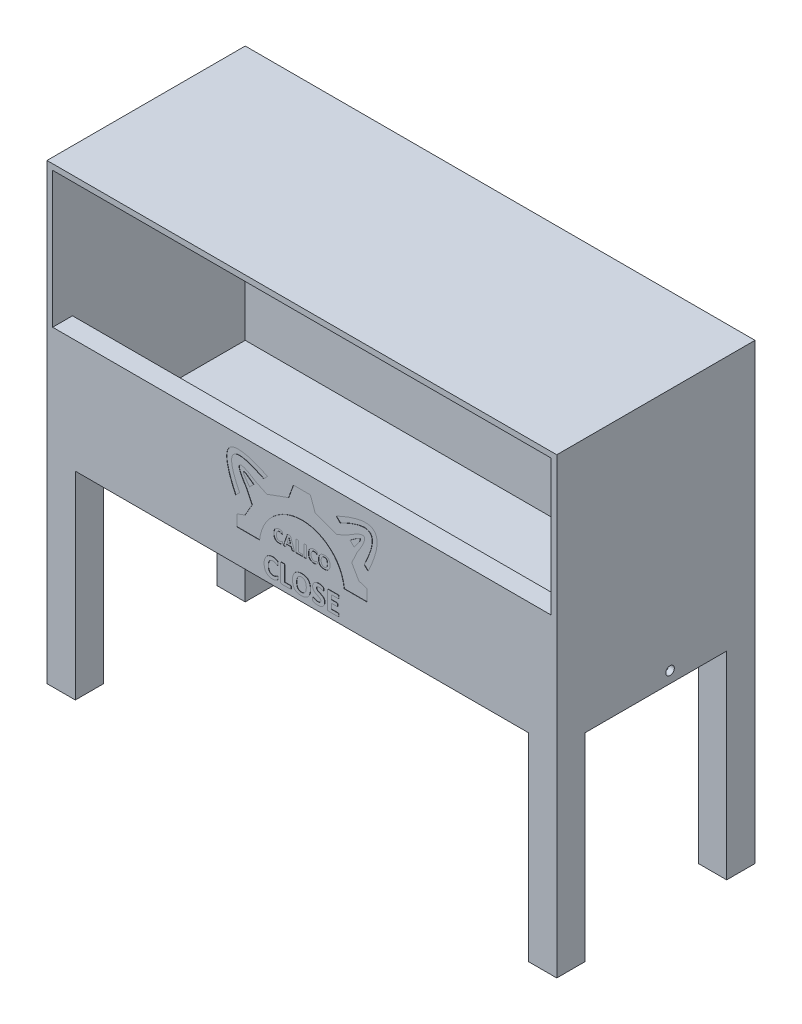
from build123d import *

# Parameters (mm, degrees)
SKETCH2_W           = 1800
SKETCH2_H           = 900
BOSS_EXTRUDE1_DEPTH = 700
SHELL1_T            = -20
SKETCH4_W           = 1800
SKETCH4_H           = 400
BOSS_EXTRUDE2_DEPTH = 20
SKETCH5_W           = 1760
SKETCH5_H           = 20
BOSS_EXTRUDE3_DEPTH = 50
SKETCH6_W           = 100
SKETCH6_H           = 100
BOSS_EXTRUDE4_DEPTH = 700
CUT_EXTRUDE3_REACH  = 2249.777
SKETCH11_R          = 15
CUT_EXTRUDE7_DEPTH  = 1
CUT_EXTRUDE8_DEPTH  = 1
BOSS_EXTRUDE5_DEPTH = 1


with BuildPart() as part:
    # Sketch2 → Boss-Extrude1 (new body)
    with BuildSketch(Plane.XY):
        Rectangle(SKETCH2_W, SKETCH2_H)
    extrude(amount=BOSS_EXTRUDE1_DEPTH)

    # Shell1
    shell1_openings = [part.faces().sort_by_distance(p)[0] for p in [
        (0, 0, 700),
    ]]
    offset(amount=SHELL1_T, openings=shell1_openings, kind=Kind.INTERSECTION)

    # Sketch4 → Boss-Extrude2 (add)
    with BuildSketch(Plane.XY.offset(700)):
        with Locations((0, -250)):
            Rectangle(SKETCH4_W, SKETCH4_H)
    extrude(amount=-BOSS_EXTRUDE2_DEPTH)

    # Sketch5 → Boss-Extrude3 (add)
    with BuildSketch(Plane(origin=(0, 0, 680), x_dir=(-1, 0, 0), z_dir=(0, 0, -1))):
        with Locations((0, -60)):
            Rectangle(SKETCH5_W, SKETCH5_H)
    extrude(amount=BOSS_EXTRUDE3_DEPTH)

    # Sketch6 → Boss-Extrude4 (add)
    with BuildSketch(Plane.XZ.offset(450)):
        with Locations((-850, 650)):
            Rectangle(SKETCH6_W, SKETCH6_H)
        with Locations((-850, 50)):
            Rectangle(SKETCH6_W, SKETCH6_H)
        with Locations((850, 50)):
            Rectangle(SKETCH6_W, SKETCH6_H)
        with Locations((850, 650)):
            Rectangle(SKETCH6_W, SKETCH6_H)
    extrude(amount=BOSS_EXTRUDE4_DEPTH)

    # Sketch11 → Cut-Extrude3 (cut, up to next)
    with BuildSketch(Plane(origin=(900, 0, 0), x_dir=(0, 0, -1), z_dir=(1, 0, 0)), mode=Mode.PRIVATE) as cut_extrude3_sk1:
        with Locations(Location((-300, -410, 0), (0, 0, 90))):
            Circle(SKETCH11_R)
    cut_extrude3_tool1 = extrude(cut_extrude3_sk1.sketch, amount=-CUT_EXTRUDE3_REACH, mode=Mode.PRIVATE) & part.part
    add(cut_extrude3_tool1.solids().sort_by_distance((900, -410, 300))[0], mode=Mode.SUBTRACT)

    # Sketch15 → Cut-Extrude7 (cut)
    # profile 1 of 3: a face of its own
    with BuildSketch(Plane.XY.offset(700)):
        with BuildLine():
            Line((-159.739380443, -165.494855592), (-123.487068962, -182.399586062))
            Line((-123.487068962, -182.399586062), (-47.101007166, -154.597333255))
            Line((-47.101007166, -154.597333255), (-30, -107.612702216))
            Line((-30, -107.612702216), (30, -107.612702216))
            Line((30, -107.612702216), (47.101007166, -154.597333255))
            Line((47.101007166, -154.597333255), (123.487068962, -182.399586062))
            Line((123.487068962, -182.399586062), (159.739380443, -165.494855592))
            add(Edge.make_bspline(
                [(159.739380443, -165.494855592), (262.269863715, -98.319711379), (195.094719502, -200.850194651)],
                knots=[0, 0, 0, 1, 1, 1], degree=2))
            Line((195.094719502, -200.850194651), (176.076897724, -241.634045068))
            Line((176.076897724, -241.634045068), (201.076897724, -284.935315257))
            Line((201.076897724, -284.935315257), (229.267676348, -295.195919557))
            Line((229.267676348, -295.195919557), (229.267676348, -335.195919557))
            Line((229.267676348, -335.195919557), (149.267676348, -335.195919557))
            ThreePointArc((149.267676348, -335.195919557), (0, -200), (-149.267676348, -335.195919557))
            Line((-149.267676348, -335.195919557), (-229.267676348, -335.195919557))
            Line((-229.267676348, -335.195919557), (-229.267676348, -295.195919557))
            Line((-229.267676348, -295.195919557), (-201.076897724, -284.935315257))
            Line((-201.076897724, -284.935315257), (-176.076897724, -241.634045068))
            Line((-176.076897724, -241.634045068), (-195.094719502, -200.850194651))
            add(Edge.make_bspline(
                [(-159.739380443, -165.494855592), (-262.269863715, -98.319711379), (-195.094719502, -200.850194651)],
                knots=[0, 0, 0, 1, 1, 1], degree=2))
        make_face()
        with BuildLine():
            Line((184.488117785, -190.243592933), (170.345982161, -176.10145731))
            add(Edge.make_bspline(
                [(170.345982161, -176.10145731), (233.985592468, -126.603982627), (184.488117785, -190.243592933)],
                knots=[0, 0, 0, 1, 1, 1], degree=2))
        make_face(mode=Mode.SUBTRACT)
        with BuildLine():
            add(Edge.make_bspline(
                [(-170.345982161, -176.10145731), (-233.985592468, -126.603982627), (-184.488117785, -190.243592933)],
                knots=[0, 0, 0, 1, 1, 1], degree=2))
            Line((-184.488117785, -190.243592933), (-170.345982161, -176.10145731))
        make_face(mode=Mode.SUBTRACT)
    # profile 2 of 3: a face of its own
    with BuildSketch(Plane.XY.offset(700)):
        with BuildLine():
            add(Edge.make_bspline(
                [(-134.990643102, -140.74611825), (-304.696270586, -55.893304508), (-219.843456844, -225.598931993)],
                knots=[0, 0, 0, 1, 1, 1], degree=2))
            Line((-219.843456844, -225.598931993), (-233.985592468, -239.741067616))
            add(Edge.make_bspline(
                [(-120.848507478, -126.603982627), (-332.980541834, -27.609033261), (-233.985592468, -239.741067616)],
                knots=[0, 0, 0, 1, 1, 1], degree=2))
            Line((-120.848507478, -126.603982627), (-134.990643102, -140.74611825))
        make_face()
    # profile 3 of 3: a face of its own
    with BuildSketch(Plane.XY.offset(700)):
        with BuildLine():
            Line((120.848507478, -126.603982627), (134.990643102, -140.74611825))
            add(Edge.make_bspline(
                [(134.990643102, -140.74611825), (304.696270586, -55.893304508), (219.843456844, -225.598931993)],
                knots=[0, 0, 0, 1, 1, 1], degree=2))
            Line((219.843456844, -225.598931993), (233.985592468, -239.741067616))
            add(Edge.make_bspline(
                [(120.848507478, -126.603982627), (332.980541834, -27.609033261), (233.985592468, -239.741067616)],
                knots=[0, 0, 0, 1, 1, 1], degree=2))
        make_face()
    extrude(amount=-CUT_EXTRUDE7_DEPTH, mode=Mode.SUBTRACT)

    # Sketch16 → Cut-Extrude8 (cut)
    # profile 1 of 6: a face of its own
    with BuildSketch(Plane.XY.offset(700)):
        with BuildLine():
            add(Edge.make_bspline(
                [(-68.169117647, -303.163061101), (-68.1694608, -303.409579145), (-68.170093462, -303.864078389), (-68.211999853, -304.49349041), (-68.264669746, -305.024016098), (-68.351140031, -305.47094076), (-68.470126206, -305.848624379), (-68.620502677, -306.194589099), (-68.862286707, -306.533596319), (-69.1069167, -306.853148187), (-69.379373769, -307.157451933), (-69.689771761, -307.415746233), (-70.07664001, -307.717525028), (-70.733910696, -308.170914471), (-71.717797889, -308.743575098), (-73.075797659, -309.399194562), (-74.667433676, -309.963478408), (-76.455242308, -310.441463704), (-78.43660149, -310.761976891), (-79.81793151, -310.799207569), (-80.532552083, -310.818468576)],
                knots=[0, 0, 0, 0, 0.817477301, 1.507162764, 2.091525744, 2.585101367, 3.013698999, 3.403571139, 3.830139735, 4.389521305, 4.739690108, 5.181838318, 5.726127005, 6.367582384, 7.828489835, 9.497787956, 11.362220851, 13.420571043, 15.630867283, 18, 18, 18, 18], degree=3))
            add(Edge.make_bspline(
                [(-80.532552083, -310.818468576), (-81.236852622, -310.800853592), (-82.610859794, -310.766488837), (-84.623962232, -310.521232809), (-86.530051125, -310.10637632), (-88.32963021, -309.521518488), (-90.015157149, -308.775226754), (-91.566323733, -307.842057386), (-92.99929279, -306.760467052), (-94.289815089, -305.503708516), (-95.448705138, -304.084696597), (-96.445306142, -302.486465142), (-97.318051323, -300.736118483), (-98.032380893, -298.817672369), (-98.61407397, -296.740653693), (-98.993624973, -294.493804308), (-99.262462855, -292.09336467), (-99.284968562, -290.437294914), (-99.296568627, -289.583710611)],
                knots=[0, 0, 0, 0, 1.04884528, 2.046173269, 3.015214692, 3.949843553, 4.859908047, 5.754373417, 6.640074381, 7.528023805, 8.430832778, 9.361986752, 10.3273752, 11.339120453, 12.406480085, 13.534714217, 14.729323304, 16, 16, 16, 16], degree=3))
            add(Edge.make_bspline(
                [(-99.296568627, -289.583710611), (-99.281752748, -288.710699552), (-99.252924994, -287.012052584), (-98.972063839, -284.540338181), (-98.532331787, -282.218799517), (-97.909616937, -280.050018219), (-97.12113812, -278.042061342), (-96.187394915, -276.192129142), (-95.10577993, -274.512398452), (-93.883052625, -272.997934751), (-92.513485833, -271.666753135), (-91.028260292, -270.484140505), (-89.402560713, -269.489864182), (-87.655160218, -268.674359926), (-85.801105658, -268.028144641), (-83.846934459, -267.579418934), (-81.802979572, -267.282024802), (-80.407177484, -267.254209427), (-79.696001838, -267.240037204)],
                knots=[0, 0, 0, 0, 1.247364886, 2.427039795, 3.55045214, 4.621200906, 5.64704897, 6.629476075, 7.578181143, 8.497404382, 9.405200954, 10.302706402, 11.205651615, 12.122019826, 13.054178336, 14.006318378, 14.984198529, 16, 16, 16, 16], degree=3))
            add(Edge.make_bspline(
                [(-79.696001838, -267.240037204), (-79.118065153, -267.254955755), (-77.98048493, -267.284320649), (-76.31801776, -267.516292429), (-74.755494231, -267.86295836), (-73.307178789, -268.304449073), (-71.984073877, -268.809148425), (-70.991167856, -269.313702253), (-70.29063622, -269.724298529), (-69.853184081, -269.998630375), (-69.506103385, -270.264214953), (-69.179774892, -270.569325088), (-68.881799268, -270.894284394), (-68.6195676, -271.256935854), (-68.462202206, -271.640789587), (-68.3535986, -272.073501746), (-68.264102999, -272.590494035), (-68.212360512, -273.198822613), (-68.169595011, -273.925352519), (-68.169286841, -274.451137276), (-68.169117647, -274.739807424)],
                knots=[0, 0, 0, 0, 1.99247574, 3.921884623, 5.777623321, 7.507428254, 9.139636718, 10.654923546, 11.341526285, 11.940176233, 12.43448366, 12.845959356, 13.479321404, 13.953882042, 14.379694984, 14.900487377, 15.490617055, 16.187164526, 17.004703962, 18, 18, 18, 18], degree=3))
            add(Edge.make_bspline(
                [(-68.169117647, -274.739807424), (-68.173233311, -275.051125753), (-68.180827422, -275.625561798), (-68.224573753, -276.415347299), (-68.306103281, -277.06436401), (-68.431684293, -277.580549267), (-68.622065749, -277.964741177), (-68.835004248, -278.240733056), (-69.091731363, -278.419388902), (-69.282133954, -278.43720255), (-69.375306373, -278.445919557)],
                knots=[0, 0, 0, 0, 1.773747753, 3.272870731, 4.503340964, 5.498117188, 6.282928042, 6.926292104, 7.474587188, 8, 8, 8, 8], degree=3))
            add(Edge.make_bspline(
                [(-69.375306373, -278.445919557), (-69.463697759, -278.436663353), (-69.655566347, -278.416571183), (-69.949633854, -278.29793437), (-70.276624638, -278.119575831), (-70.774875075, -277.749692648), (-71.522264482, -277.203852861), (-72.601993744, -276.533675332), (-73.899028351, -275.84707954), (-75.147404168, -275.356169825), (-76.265041436, -275.022993522), (-77.208890362, -274.837679706), (-78.231314675, -274.733958347), (-78.940275231, -274.718578835), (-79.306908701, -274.710625439)],
                knots=[0, 0, 0, 0, 0.294660949, 0.639611878, 1.045415135, 1.533607636, 2.701972583, 4.127801724, 5.759893443, 7.582166846, 8.583129585, 9.639604504, 10.779339718, 12, 12, 12, 12], degree=3))
            add(Edge.make_bspline(
                [(-79.306908701, -274.710625439), (-79.716438234, -274.719094661), (-80.514524999, -274.73559939), (-81.674290962, -274.944391525), (-82.773150045, -275.246608294), (-83.797788225, -275.699072052), (-84.744264338, -276.270966425), (-85.631565409, -276.935131604), (-86.439193148, -277.71802464), (-87.172180292, -278.609459529), (-87.821376848, -279.60243637), (-88.389467662, -280.694610473), (-88.874810509, -281.882861502), (-89.270729232, -283.169412423), (-89.58006934, -284.545267102), (-89.80471022, -286.007495977), (-89.926397449, -287.555114637), (-89.947525361, -288.614023723), (-89.958333333, -289.15570816)],
                knots=[0, 0, 0, 0, 0.972080817, 1.89438068, 2.79201181, 3.675405302, 4.546341706, 5.415605955, 6.303960111, 7.212703157, 8.153143135, 9.118265211, 10.13431466, 11.199471373, 12.313676298, 13.483115176, 14.712488772, 16, 16, 16, 16], degree=3))
            add(Edge.make_bspline(
                [(-89.958333333, -289.15570816), (-89.950039355, -289.746208593), (-89.934016464, -290.88697881), (-89.782070954, -292.536751551), (-89.558407584, -294.066626171), (-89.224699951, -295.474067228), (-88.813016214, -296.762837093), (-88.300585288, -297.928937603), (-87.723285642, -298.983830677), (-87.056603049, -299.917461975), (-86.310946442, -300.733068134), (-85.489549597, -301.436623375), (-84.598066572, -302.033630494), (-83.637619295, -302.527522898), (-82.601603864, -302.892669004), (-81.502367102, -303.152439171), (-80.343547536, -303.326719213), (-79.547503357, -303.340733477), (-79.141544118, -303.347880341)],
                knots=[0, 0, 0, 0, 1.39820726, 2.701155002, 3.920851914, 5.057115416, 6.123247462, 7.120555937, 8.069346848, 8.966541661, 9.830790757, 10.680415293, 11.521739042, 12.366630257, 13.231390995, 14.116141633, 15.039287353, 16, 16, 16, 16], degree=3))
            add(Edge.make_bspline(
                [(-79.141544118, -303.347880341), (-78.774876766, -303.340177616), (-78.069075689, -303.325350575), (-77.047129758, -303.218653914), (-76.105566981, -303.038162251), (-74.983334898, -302.699882222), (-73.742184409, -302.192857848), (-72.447426558, -301.506559438), (-71.375470898, -300.837057776), (-70.618570457, -300.311362687), (-70.121465947, -299.93790488), (-69.798337595, -299.765870311), (-69.522994772, -299.643581255), (-69.347000611, -299.622163195), (-69.26830576, -299.612586224)],
                knots=[0, 0, 0, 0, 1.227460679, 2.362749415, 3.435761231, 4.43188492, 6.282452832, 7.914022885, 9.332840532, 10.51031958, 11.001231841, 11.409295861, 11.73586979, 12, 12, 12, 12], degree=3))
            add(Edge.make_bspline(
                [(-69.26830576, -299.612586224), (-69.170256462, -299.616082063), (-68.990645165, -299.622485905), (-68.735147175, -299.725304515), (-68.547648333, -299.952621266), (-68.40938993, -300.28932493), (-68.294552726, -300.757698611), (-68.225684978, -301.38776571), (-68.178715665, -302.205805505), (-68.172564841, -302.819256188), (-68.169117647, -303.163061101)],
                knots=[0, 0, 0, 0, 0.574868731, 1.05307148, 1.566117152, 2.257286433, 3.182192672, 4.393071976, 5.978517896, 8, 8, 8, 8], degree=3))
        make_face()
    # profile 2 of 6: a face of its own
    with BuildSketch(Plane.XY.offset(700)):
        with BuildLine():
            add(Edge.make_bspline(
                [(-26.769607843, -306.820536591), (-26.705744616, -307.00465558), (-26.586691793, -307.347887297), (-26.451659385, -307.843396944), (-26.343500166, -308.274011946), (-26.269767248, -308.649502905), (-26.242030542, -308.974691981), (-26.283090421, -309.255156844), (-26.366869839, -309.502957825), (-26.532873507, -309.701702742), (-26.756090741, -309.86367119), (-27.052520052, -309.974201904), (-27.409335326, -310.073500905), (-27.841555224, -310.126077543), (-28.34862171, -310.147013732), (-28.935130262, -310.183730826), (-29.613284533, -310.184848795), (-30.093132576, -310.192066766), (-30.349264706, -310.195919557)],
                knots=[0, 0, 0, 0, 1.351975101, 2.52033068, 3.562719996, 4.432170766, 5.176088948, 5.812532786, 6.389296298, 6.965620705, 7.577732788, 8.283941723, 9.146375963, 10.145613058, 11.295182858, 12.669444765, 14.222224263, 16, 16, 16, 16], degree=3))
            add(Edge.make_bspline(
                [(-30.349264706, -310.195919557), (-30.611899078, -310.196544775), (-31.108008741, -310.197725797), (-31.805304337, -310.189979484), (-32.411431218, -310.16666229), (-33.06127378, -310.148849896), (-33.712303596, -310.086895974), (-34.338310075, -309.984764795), (-34.787555687, -309.813670599), (-35.093523595, -309.561330607), (-35.268183998, -309.22758967), (-35.352412492, -308.990752355), (-35.397748162, -308.863275562)],
                knots=[0, 0, 0, 0, 1.402041787, 2.648421349, 3.722147351, 4.640185661, 6.117966101, 7.211050041, 8.017924191, 8.656254393, 9.276733986, 10, 10, 10, 10], degree=3))
            Line((-35.397748162, -308.863275562), (-37.985217525, -300.857684263))
            Line((-37.985217525, -300.857684263), (-53.957490809, -300.857684263))
            Line((-53.957490809, -300.857684263), (-56.408777574, -308.639547008))
            add(Edge.make_bspline(
                [(-56.408777574, -308.639547008), (-56.45314158, -308.780378722), (-56.537623589, -309.048563387), (-56.729462739, -309.418990347), (-57.038443994, -309.711101956), (-57.474091526, -309.930417117), (-58.075732269, -310.062039388), (-58.863425443, -310.157743213), (-59.884720843, -310.179488858), (-60.643500241, -310.190023572), (-61.068167892, -310.195919557)],
                knots=[0, 0, 0, 0, 0.662368552, 1.261342941, 1.847645799, 2.537239812, 3.42265718, 4.595262896, 6.094463672, 8, 8, 8, 8], degree=3))
            add(Edge.make_bspline(
                [(-61.068167892, -310.195919557), (-61.304876891, -310.193479161), (-61.752434143, -310.188864986), (-62.384895614, -310.170184187), (-62.93618867, -310.140679136), (-63.41137523, -310.10774443), (-63.809888381, -310.043231347), (-64.145017591, -309.945052937), (-64.415953562, -309.815752983), (-64.694814326, -309.587747256), (-64.879754451, -309.145760932), (-64.858285959, -308.495800674), (-64.65292774, -307.690351081), (-64.463398214, -307.091674196), (-64.356004902, -306.752445292)],
                knots=[0, 0, 0, 0, 1.279822224, 2.419822313, 3.420424811, 4.264789446, 4.993926375, 5.598399463, 6.14718048, 6.607326483, 7.517039103, 8.604050794, 10.075749779, 12, 12, 12, 12], degree=3))
            Line((-64.356004902, -306.752445292), (-51.554840686, -269.545414042))
            add(Edge.make_bspline(
                [(-51.554840686, -269.545414042), (-51.487954763, -269.378185365), (-51.364265726, -269.068937123), (-51.117871224, -268.646748912), (-50.748248965, -268.317001963), (-50.210573479, -268.113379049), (-49.507640341, -267.959315213), (-48.783301287, -267.91223557), (-48.085507547, -267.891503785), (-47.45328277, -267.869031899), (-46.739838893, -267.860654384), (-46.237235713, -267.861917843), (-45.971354167, -267.862586224)],
                knots=[0, 0, 0, 0, 0.856868194, 1.584566637, 2.305859304, 3.162727498, 4.285524966, 5.725550839, 6.605441018, 7.608682037, 8.734971556, 10, 10, 10, 10], degree=3))
            add(Edge.make_bspline(
                [(-45.971354167, -267.862586224), (-45.666563381, -267.861945593), (-45.086144834, -267.86072563), (-44.265714846, -267.868852994), (-43.542677083, -267.89127545), (-42.754231688, -267.912599088), (-41.946038162, -267.95744731), (-41.161577188, -268.112646486), (-40.570880739, -268.32023855), (-40.159293449, -268.664790308), (-39.891675347, -269.119165622), (-39.771908126, -269.458601012), (-39.706954657, -269.642687326)],
                knots=[0, 0, 0, 0, 1.298203691, 2.47219252, 3.494555852, 4.378870695, 5.833194716, 6.932857721, 7.781737059, 8.467837287, 9.169060755, 10, 10, 10, 10], degree=3))
            Line((-39.706954657, -269.642687326), (-26.769607843, -306.820536591))
        make_face()
        Polygon((-46.068627451, -275.770904238), (-46.097809436, -275.770904238), (-51.807751225, -294.009645047), (-40.193321078, -294.009645047), align=None, mode=Mode.SUBTRACT)
    # profile 3 of 6: a face of its own
    with BuildSketch(Plane.XY.offset(700)):
        with BuildLine():
            add(Edge.make_bspline(
                [(2.178921569, -306.723263307), (2.177224909, -307.012083892), (2.174092628, -307.545288704), (2.10272239, -308.272433335), (2.012507436, -308.877481228), (1.870212326, -309.362756674), (1.691857615, -309.748186528), (1.453863688, -310.019694823), (1.158429073, -310.167205439), (0.951501241, -310.186240267), (0.846277574, -310.195919557)],
                knots=[0, 0, 0, 0, 1.69995762, 3.138369049, 4.299922826, 5.296754232, 6.108045987, 6.783725302, 7.381519227, 8, 8, 8, 8], degree=3))
            Line((0.846277574, -310.195919557), (-18.880744485, -310.195919557))
            add(Edge.make_bspline(
                [(-18.880744485, -310.195919557), (-19.056344164, -310.188512699), (-19.398696383, -310.17407216), (-19.893576556, -310.059565549), (-20.334905501, -309.844748806), (-20.745811605, -309.577729096), (-21.084468324, -309.199838703), (-21.321291317, -308.712624785), (-21.45107947, -308.130667084), (-21.46864434, -307.712861055), (-21.477941176, -307.491722253)],
                knots=[0, 0, 0, 0, 0.988206998, 1.926625728, 2.832905899, 3.739002297, 4.669579943, 5.648984647, 6.755640938, 8, 8, 8, 8], degree=3))
            Line((-21.477941176, -307.491722253), (-21.477941176, -269.234139532))
            add(Edge.make_bspline(
                [(-21.477941176, -269.234139532), (-21.465733483, -269.128262216), (-21.441433813, -268.917511182), (-21.265743455, -268.622317838), (-20.966676385, -268.370611485), (-20.513110925, -268.197301761), (-19.921010003, -268.057449443), (-19.156550787, -267.942302171), (-18.204611755, -267.86569761), (-17.502892162, -267.86368443), (-17.120098039, -267.862586224)],
                knots=[0, 0, 0, 0, 0.51358715, 1.022306066, 1.626293916, 2.38232859, 3.357940148, 4.587254232, 6.138317588, 8, 8, 8, 8], degree=3))
            add(Edge.make_bspline(
                [(-17.120098039, -267.862586224), (-16.730778386, -267.863307404), (-16.025734047, -267.864613438), (-15.070923633, -267.943428211), (-14.312050211, -268.055619006), (-13.724811168, -268.199253276), (-13.272015623, -268.3697585), (-12.977247472, -268.625490658), (-12.784709002, -268.913580436), (-12.76971133, -269.127690113), (-12.762254902, -269.234139532)],
                knots=[0, 0, 0, 0, 1.891840835, 3.426057895, 4.654471675, 5.614083843, 6.369564826, 6.973110337, 7.489458814, 8, 8, 8, 8], degree=3))
            Line((-12.762254902, -269.234139532), (-12.762254902, -303.347880341))
            Line((-12.762254902, -303.347880341), (0.846277574, -303.347880341))
            add(Edge.make_bspline(
                [(0.846277574, -303.347880341), (0.952082143, -303.352717227), (1.157670185, -303.362115744), (1.438880185, -303.518621046), (1.681096365, -303.760356307), (1.859203391, -304.123566124), (2.020484606, -304.584820579), (2.099631659, -305.181413297), (2.175387529, -305.904169741), (2.177674977, -306.434337501), (2.178921569, -306.723263307)],
                knots=[0, 0, 0, 0, 0.628853991, 1.221921344, 1.883771067, 2.660348459, 3.628496149, 4.814630856, 6.264067687, 8, 8, 8, 8], degree=3))
        make_face()
    # profile 4 of 6: a face of its own
    with BuildSketch(Plane.XY.offset(700)):
        with BuildLine():
            add(Edge.make_bspline(
                [(15.875, -308.834093576), (15.866344102, -308.936680611), (15.848421766, -309.149090629), (15.666670515, -309.4424182), (15.358394814, -309.684750959), (14.917813174, -309.875966467), (14.322254867, -309.996086526), (13.567595596, -310.120496212), (12.610550402, -310.176981755), (11.906239646, -310.189180563), (11.517156863, -310.195919557)],
                knots=[0, 0, 0, 0, 0.495621344, 1.026201209, 1.620351712, 2.38321719, 3.340319487, 4.57034235, 6.105352312, 8, 8, 8, 8], degree=3))
            add(Edge.make_bspline(
                [(11.517156863, -310.195919557), (11.134590298, -310.188879651), (10.433592363, -310.175980042), (9.479450587, -310.121610182), (8.719155273, -309.994301773), (8.118754487, -309.877973709), (7.677422632, -309.6839342), (7.364894993, -309.445422616), (7.200020023, -309.145240494), (7.172664639, -308.936144015), (7.159313725, -308.834093576)],
                knots=[0, 0, 0, 0, 1.864371396, 3.416191113, 4.647059884, 5.620195157, 6.383585271, 6.978144381, 7.501278959, 8, 8, 8, 8], degree=3))
            Line((7.159313725, -308.834093576), (7.159313725, -269.224412204))
            add(Edge.make_bspline(
                [(7.159313725, -269.224412204), (7.171719564, -269.118774848), (7.196413647, -268.908501461), (7.369202891, -268.609152445), (7.684080036, -268.375861179), (8.13509065, -268.19370742), (8.733480118, -268.059785531), (9.493454781, -267.94287739), (10.439156045, -267.865064894), (11.134379693, -267.863466351), (11.517156863, -267.862586224)],
                knots=[0, 0, 0, 0, 0.514492339, 1.024107864, 1.631220341, 2.388587514, 3.381256653, 4.612737383, 6.135036404, 8, 8, 8, 8], degree=3))
            add(Edge.make_bspline(
                [(11.517156863, -267.862586224), (11.90646213, -267.863324132), (12.611480416, -267.864660458), (13.566447731, -267.9432928), (14.324892806, -268.055981638), (14.913256279, -268.198308522), (15.361118353, -268.371492192), (15.662759411, -268.615728483), (15.852185711, -268.90427868), (15.867423962, -269.118104106), (15.875, -269.224412204)],
                knots=[0, 0, 0, 0, 1.894249435, 3.430419785, 4.660397522, 5.621231422, 6.377674247, 6.971802951, 7.488808818, 8, 8, 8, 8], degree=3))
            Line((15.875, -269.224412204), (15.875, -308.834093576))
        make_face()
    # profile 5 of 6: a face of its own
    with BuildSketch(Plane.XY.offset(700)):
        with BuildLine():
            add(Edge.make_bspline(
                [(54.473039216, -303.163061101), (54.472696063, -303.409579145), (54.472063401, -303.864078389), (54.43015701, -304.49349041), (54.377487117, -305.024016098), (54.291016832, -305.47094076), (54.172030657, -305.848624379), (54.021654185, -306.194589099), (53.779870156, -306.533596319), (53.535240163, -306.853148187), (53.262783094, -307.157451933), (52.952385101, -307.415746233), (52.565516853, -307.717525028), (51.908246167, -308.170914471), (50.924358974, -308.743575098), (49.566359203, -309.399194562), (47.974723187, -309.963478408), (46.186914555, -310.441463704), (44.205555373, -310.761976891), (42.824225352, -310.799207569), (42.109604779, -310.818468576)],
                knots=[0, 0, 0, 0, 0.817477301, 1.507162764, 2.091525744, 2.585101367, 3.013698999, 3.403571139, 3.830139735, 4.389521305, 4.739690108, 5.181838318, 5.726127005, 6.367582384, 7.828489835, 9.497787956, 11.362220851, 13.420571043, 15.630867283, 18, 18, 18, 18], degree=3))
            add(Edge.make_bspline(
                [(42.109604779, -310.818468576), (41.40530424, -310.800853592), (40.031297069, -310.766488837), (38.018194631, -310.521232809), (36.112105738, -310.10637632), (34.312526652, -309.521518488), (32.626999714, -308.775226754), (31.07583313, -307.842057386), (29.642864073, -306.760467052), (28.352341774, -305.503708516), (27.193451725, -304.084696597), (26.19685072, -302.486465142), (25.324105539, -300.736118483), (24.609775969, -298.817672369), (24.028082892, -296.740653693), (23.64853189, -294.493804308), (23.379694007, -292.09336467), (23.357188301, -290.437294914), (23.345588235, -289.583710611)],
                knots=[0, 0, 0, 0, 1.04884528, 2.046173269, 3.015214692, 3.949843553, 4.859908047, 5.754373417, 6.640074381, 7.528023805, 8.430832778, 9.361986752, 10.3273752, 11.339120453, 12.406480085, 13.534714217, 14.729323304, 16, 16, 16, 16], degree=3))
            add(Edge.make_bspline(
                [(23.345588235, -289.583710611), (23.360404114, -288.710699552), (23.389231869, -287.012052584), (23.670093024, -284.540338181), (24.109825076, -282.218799517), (24.732539925, -280.050018219), (25.521018743, -278.042061342), (26.454761947, -276.192129142), (27.536376933, -274.512398452), (28.759104238, -272.997934751), (30.12867103, -271.666753135), (31.61389657, -270.484140505), (33.23959615, -269.489864182), (34.986996645, -268.674359926), (36.841051205, -268.028144641), (38.795222403, -267.579418934), (40.83917729, -267.282024802), (42.234979379, -267.254209427), (42.946155025, -267.240037204)],
                knots=[0, 0, 0, 0, 1.247364886, 2.427039795, 3.55045214, 4.621200906, 5.64704897, 6.629476075, 7.578181143, 8.497404382, 9.405200954, 10.302706402, 11.205651615, 12.122019826, 13.054178336, 14.006318378, 14.984198529, 16, 16, 16, 16], degree=3))
            add(Edge.make_bspline(
                [(42.946155025, -267.240037204), (43.524091709, -267.254955755), (44.661671933, -267.284320649), (46.324139103, -267.516292429), (47.886662632, -267.86295836), (49.334978074, -268.304449073), (50.658082986, -268.809148425), (51.650989007, -269.313702253), (52.351520642, -269.724298529), (52.788972781, -269.998630375), (53.136053477, -270.264214953), (53.462381971, -270.569325088), (53.760357595, -270.894284394), (54.022589262, -271.256935854), (54.179954657, -271.640789587), (54.288558263, -272.073501746), (54.378053864, -272.590494035), (54.429796351, -273.198822613), (54.472561852, -273.925352519), (54.472870022, -274.451137276), (54.473039216, -274.739807424)],
                knots=[0, 0, 0, 0, 1.99247574, 3.921884623, 5.777623321, 7.507428254, 9.139636718, 10.654923546, 11.341526285, 11.940176233, 12.43448366, 12.845959356, 13.479321404, 13.953882042, 14.379694984, 14.900487377, 15.490617055, 16.187164526, 17.004703962, 18, 18, 18, 18], degree=3))
            add(Edge.make_bspline(
                [(54.473039216, -274.739807424), (54.468923551, -275.051125753), (54.46132944, -275.625561798), (54.41758311, -276.415347299), (54.336053582, -277.06436401), (54.21047257, -277.580549267), (54.020091114, -277.964741177), (53.807152615, -278.240733056), (53.5504255, -278.419388902), (53.360022908, -278.43720255), (53.26685049, -278.445919557)],
                knots=[0, 0, 0, 0, 1.773747753, 3.272870731, 4.503340964, 5.498117188, 6.282928042, 6.926292104, 7.474587188, 8, 8, 8, 8], degree=3))
            add(Edge.make_bspline(
                [(53.26685049, -278.445919557), (53.178459104, -278.436663353), (52.986590516, -278.416571183), (52.692523009, -278.29793437), (52.365532225, -278.119575831), (51.867281787, -277.749692648), (51.119892381, -277.203852861), (50.040163119, -276.533675332), (48.743128512, -275.84707954), (47.494752694, -275.356169825), (46.377115427, -275.022993522), (45.433266501, -274.837679706), (44.410842188, -274.733958347), (43.701881632, -274.718578835), (43.335248162, -274.710625439)],
                knots=[0, 0, 0, 0, 0.294660949, 0.639611878, 1.045415135, 1.533607636, 2.701972583, 4.127801724, 5.759893443, 7.582166846, 8.583129585, 9.639604504, 10.779339718, 12, 12, 12, 12], degree=3))
            add(Edge.make_bspline(
                [(43.335248162, -274.710625439), (42.925718629, -274.719094661), (42.127631864, -274.73559939), (40.967865901, -274.944391525), (39.869006818, -275.246608294), (38.844368638, -275.699072052), (37.897892525, -276.270966425), (37.010591454, -276.935131604), (36.202963714, -277.71802464), (35.46997657, -278.609459529), (34.820780015, -279.60243637), (34.252689201, -280.694610473), (33.767346354, -281.882861502), (33.371427631, -283.169412423), (33.062087523, -284.545267102), (32.837446643, -286.007495977), (32.715759413, -287.555114637), (32.694631502, -288.614023723), (32.683823529, -289.15570816)],
                knots=[0, 0, 0, 0, 0.972080817, 1.89438068, 2.79201181, 3.675405302, 4.546341706, 5.415605955, 6.303960111, 7.212703157, 8.153143135, 9.118265211, 10.13431466, 11.199471373, 12.313676298, 13.483115176, 14.712488772, 16, 16, 16, 16], degree=3))
            add(Edge.make_bspline(
                [(32.683823529, -289.15570816), (32.692117508, -289.746208593), (32.708140399, -290.88697881), (32.860085909, -292.536751551), (33.083749279, -294.066626171), (33.417456911, -295.474067228), (33.829140649, -296.762837093), (34.341571575, -297.928937603), (34.918871221, -298.983830677), (35.585553813, -299.917461975), (36.331210421, -300.733068134), (37.152607266, -301.436623375), (38.044090291, -302.033630494), (39.004537568, -302.527522898), (40.040552999, -302.892669004), (41.139789761, -303.152439171), (42.298609327, -303.326719213), (43.094653505, -303.340733477), (43.500612745, -303.347880341)],
                knots=[0, 0, 0, 0, 1.39820726, 2.701155002, 3.920851914, 5.057115416, 6.123247462, 7.120555937, 8.069346848, 8.966541661, 9.830790757, 10.680415293, 11.521739042, 12.366630257, 13.231390995, 14.116141633, 15.039287353, 16, 16, 16, 16], degree=3))
            add(Edge.make_bspline(
                [(43.500612745, -303.347880341), (43.867280097, -303.340177616), (44.573081174, -303.325350575), (45.595027104, -303.218653914), (46.536589882, -303.038162251), (47.658821965, -302.699882222), (48.899972454, -302.192857848), (50.194730305, -301.506559438), (51.266685965, -300.837057776), (52.023586406, -300.311362687), (52.520690916, -299.93790488), (52.843819267, -299.765870311), (53.119162091, -299.643581255), (53.295156251, -299.622163195), (53.373851103, -299.612586224)],
                knots=[0, 0, 0, 0, 1.227460679, 2.362749415, 3.435761231, 4.43188492, 6.282452832, 7.914022885, 9.332840532, 10.51031958, 11.001231841, 11.409295861, 11.73586979, 12, 12, 12, 12], degree=3))
            add(Edge.make_bspline(
                [(53.373851103, -299.612586224), (53.4719004, -299.616082063), (53.651511698, -299.622485905), (53.907009688, -299.725304515), (54.09450853, -299.952621266), (54.232766933, -300.28932493), (54.347604137, -300.757698611), (54.416471885, -301.38776571), (54.463441198, -302.205805505), (54.469592022, -302.819256188), (54.473039216, -303.163061101)],
                knots=[0, 0, 0, 0, 0.574868731, 1.05307148, 1.566117152, 2.257286433, 3.182192672, 4.393071976, 5.978517896, 8, 8, 8, 8], degree=3))
        make_face()
    # profile 6 of 6: a face of its own
    with BuildSketch(Plane.XY.offset(700)):
        with BuildLine():
            add(Edge.make_bspline(
                [(99.296568627, -288.542886469), (99.284338941, -289.393148666), (99.260475041, -291.05227313), (98.996470075, -293.466973345), (98.598306939, -295.75031308), (98.013197579, -297.887700471), (97.278851109, -299.885588062), (96.369403852, -301.722875149), (95.306698276, -303.410598067), (94.075785083, -304.935153556), (92.685060122, -306.296300004), (91.139831265, -307.491724847), (89.431395214, -308.505350297), (87.577669949, -309.354216785), (85.569081248, -310.019355707), (83.406052626, -310.477591806), (81.094711773, -310.764640632), (79.502330555, -310.800201664), (78.684359681, -310.818468576)],
                knots=[0, 0, 0, 0, 1.181067455, 2.304627813, 3.371397041, 4.398875488, 5.379772852, 6.324840374, 7.24235265, 8.145895775, 9.041233988, 9.940678369, 10.854054564, 11.795635534, 12.76881339, 13.787809768, 14.863646999, 16, 16, 16, 16], degree=3))
            add(Edge.make_bspline(
                [(78.684359681, -310.818468576), (77.879528611, -310.805525727), (76.317826019, -310.780411287), (74.05460004, -310.52998727), (71.946082224, -310.141843244), (69.996439527, -309.576878669), (68.203150096, -308.848357148), (66.565345698, -307.945969815), (65.072870398, -306.885845132), (63.748927945, -305.635213211), (62.58261822, -304.212944584), (61.579240485, -302.610926644), (60.718087338, -300.838180273), (60.022112826, -298.879830888), (59.478028029, -296.743878142), (59.109987713, -294.422012477), (58.870750373, -291.920042162), (58.844466847, -290.187398149), (58.830882353, -289.291890758)],
                knots=[0, 0, 0, 0, 1.14605125, 2.223809784, 3.239278066, 4.196657126, 5.110123641, 5.990760065, 6.854667985, 7.710749604, 8.577135683, 9.46770869, 10.397275983, 11.379066547, 12.423123567, 13.532494508, 14.724683554, 16, 16, 16, 16], degree=3))
            add(Edge.make_bspline(
                [(58.830882353, -289.291890758), (58.848861799, -288.461300925), (58.883987162, -286.838627532), (59.123459106, -284.469248696), (59.545717748, -282.232901615), (60.113309252, -280.124021627), (60.852028915, -278.15131335), (61.754839972, -276.326968793), (62.823830326, -274.655791718), (64.054439129, -273.142012211), (65.441907792, -271.781017421), (66.986385871, -270.589556891), (68.687672477, -269.569336818), (70.544667617, -268.724033887), (72.557810683, -268.048893424), (74.726922989, -267.579351596), (77.049010461, -267.293603097), (78.64783864, -267.258261219), (79.472273284, -267.240037204)],
                knots=[0, 0, 0, 0, 1.160914008, 2.268007866, 3.323978369, 4.338756358, 5.316875162, 6.263384146, 7.178594241, 8.083875972, 8.984426194, 9.889106488, 10.803912537, 11.750974708, 12.735550296, 13.765875032, 14.847975007, 16, 16, 16, 16], degree=3))
            add(Edge.make_bspline(
                [(79.472273284, -267.240037204), (80.260875982, -267.253133373), (81.793433875, -267.278584259), (84.018152536, -267.528040414), (86.098255707, -267.921734132), (88.036547576, -268.472159962), (89.827501476, -269.194484563), (91.474549584, -270.075852115), (92.959152311, -271.149851962), (94.287565389, -272.395414686), (95.477840793, -273.802073173), (96.4864864, -275.396779598), (97.36135081, -277.150826609), (98.065537766, -279.087509359), (98.618010325, -281.198080221), (99.010373137, -283.485767292), (99.258636432, -285.953177694), (99.283641339, -287.660313962), (99.296568627, -288.542886469)],
                knots=[0, 0, 0, 0, 1.132472299, 2.200828589, 3.21116476, 4.170875335, 5.090315408, 5.980258557, 6.84769598, 7.714420291, 8.590505985, 9.487188694, 10.418317356, 11.401257481, 12.441795894, 13.548338263, 14.732515217, 16, 16, 16, 16], degree=3))
        make_face()
        with BuildLine():
            add(Edge.make_bspline(
                [(89.958333333, -289.009798233), (89.953728063, -288.461672538), (89.944727761, -287.390444056), (89.845491746, -285.822576106), (89.682994273, -284.332045332), (89.449705152, -282.922650389), (89.156641289, -281.591837523), (88.761736999, -280.359603012), (88.268475424, -279.228137467), (87.699759968, -278.190848147), (87.02340538, -277.256693951), (86.241826836, -276.430754282), (85.345030195, -275.730032046), (84.355343715, -275.124330066), (83.239904762, -274.658342655), (82.002869897, -274.314418886), (80.632292891, -274.126973587), (79.677087816, -274.101382072), (79.180453431, -274.08807642)],
                knots=[0, 0, 0, 0, 1.248306964, 2.439626501, 3.576526119, 4.66195957, 5.692118455, 6.677712867, 7.603820791, 8.499754584, 9.366886977, 10.223578091, 11.080555655, 11.951954716, 12.85865995, 13.824437323, 14.868871972, 16, 16, 16, 16], degree=3))
            add(Edge.make_bspline(
                [(79.180453431, -274.08807642), (78.676979131, -274.102470503), (77.710069198, -274.130113985), (76.320380818, -274.355760877), (75.058425578, -274.729895031), (73.925269329, -275.262768463), (72.920000645, -275.922427866), (72.012960979, -276.677441076), (71.212536765, -277.539802415), (70.512503179, -278.498703796), (69.899904732, -279.544797646), (69.417008608, -280.692667996), (68.985624277, -281.909242186), (68.689571101, -283.214139373), (68.456196911, -284.572021092), (68.29654151, -285.975327429), (68.179902388, -287.415795749), (68.172741333, -288.390245324), (68.169117647, -288.883342964)],
                knots=[0, 0, 0, 0, 1.153225958, 2.214741912, 3.216094119, 4.16009031, 5.073077605, 5.964494141, 6.858230186, 7.761795903, 8.68066018, 9.629003448, 10.611206296, 11.634860154, 12.690273443, 13.767663655, 14.870377893, 16, 16, 16, 16], degree=3))
            add(Edge.make_bspline(
                [(68.169117647, -288.883342964), (68.173863835, -289.450891673), (68.183119621, -290.557697603), (68.279589808, -292.171334265), (68.44949072, -293.69578009), (68.660127133, -295.135290722), (68.973923702, -296.477101721), (69.358524458, -297.727639212), (69.846824573, -298.871513753), (70.405559957, -299.923507166), (71.074743443, -300.862720013), (71.853475886, -301.682673293), (72.745195034, -302.379790806), (73.73221865, -302.97381989), (74.855534453, -303.423840742), (76.102392584, -303.735827159), (77.481619525, -303.934630834), (78.443684921, -303.958133659), (78.946997549, -303.970429361)],
                knots=[0, 0, 0, 0, 1.279653928, 2.495518946, 3.642823718, 4.737874749, 5.773595616, 6.747088542, 7.68406817, 8.573908718, 9.428072391, 10.276175527, 11.114292987, 11.973199623, 12.865200127, 13.831639063, 14.865603682, 16, 16, 16, 16], degree=3))
            add(Edge.make_bspline(
                [(78.946997549, -303.970429361), (79.450493931, -303.956164804), (80.417446272, -303.928770076), (81.802845234, -303.702057206), (83.060774755, -303.33608879), (84.195305536, -302.81734348), (85.197548577, -302.151329021), (86.117628469, -301.404063531), (86.913676285, -300.526862781), (87.619377506, -299.558742123), (88.221429773, -298.492799846), (88.728185545, -297.33886552), (89.13571364, -296.100465175), (89.44050365, -294.783451218), (89.67145057, -293.405254987), (89.830917057, -291.976151864), (89.947526814, -290.506479917), (89.954702833, -289.512615419), (89.958333333, -289.009798233)],
                knots=[0, 0, 0, 0, 1.144095152, 2.197206425, 3.181453363, 4.114866049, 5.020624657, 5.910648687, 6.802715632, 7.705078328, 8.629453105, 9.579998293, 10.566037856, 11.588758084, 12.650348858, 13.741173613, 14.857211693, 16, 16, 16, 16], degree=3))
        make_face(mode=Mode.SUBTRACT)
    extrude(amount=-CUT_EXTRUDE8_DEPTH, mode=Mode.SUBTRACT)

    # Sketch17 → Boss-Extrude5 (add)
    # profile 1 of 5: a face of its own
    with BuildSketch(Plane.XY.offset(700)):
        with BuildLine():
            add(Edge.make_bspline(
                [(-83.65502451, -419.011158663), (-83.655560686, -419.396343106), (-83.65654922, -420.106498176), (-83.722027957, -421.089954459), (-83.804324664, -421.918900846), (-83.939434484, -422.617220629), (-84.125350383, -423.207351284), (-84.360313619, -423.74792116), (-84.738101166, -424.277619941), (-85.12033553, -424.776919735), (-85.546049701, -425.252394338), (-86.031046563, -425.655979182), (-86.635528201, -426.127508549), (-87.662513649, -426.835929554), (-89.199837387, -427.730711783), (-91.321712029, -428.755117196), (-93.808643305, -429.636810705), (-96.602094292, -430.383662731), (-99.697968014, -430.884464585), (-101.856296171, -430.942637519), (-102.972890816, -430.972732843)],
                knots=[0, 0, 0, 0, 0.817477301, 1.507162764, 2.091525744, 2.585101367, 3.013698999, 3.403571139, 3.830139735, 4.389521305, 4.739690108, 5.181838318, 5.726127005, 6.367582384, 7.828489835, 9.497787956, 11.362220851, 13.420571043, 15.630867283, 18, 18, 18, 18], degree=3))
            add(Edge.make_bspline(
                [(-102.972890816, -430.972732843), (-104.073360409, -430.94520943), (-106.220246615, -430.8915145), (-109.365719174, -430.508301957), (-112.343983068, -429.860088693), (-115.15582539, -428.94624833), (-117.789461231, -427.780167495), (-120.213159019, -426.322090359), (-122.452173171, -424.632105461), (-124.468614263, -422.668420249), (-126.279379964, -420.451214125), (-127.836569034, -417.953977477), (-129.200233379, -415.219060822), (-130.316373332, -412.221488768), (-131.225268765, -408.976147089), (-131.818317207, -405.465444924), (-132.238376398, -401.714757989), (-132.273541564, -399.127148995), (-132.291666667, -397.793423522)],
                knots=[0, 0, 0, 0, 1.04884528, 2.046173269, 3.015214692, 3.949843553, 4.859908047, 5.754373417, 6.640074381, 7.528023805, 8.430832778, 9.361986752, 10.3273752, 11.339120453, 12.406480085, 13.534714217, 14.729323304, 16, 16, 16, 16], degree=3))
            add(Edge.make_bspline(
                [(-132.291666667, -397.793423522), (-132.268516856, -396.429343742), (-132.22347349, -393.775207854), (-131.784627934, -389.9131541), (-131.097546603, -386.285749938), (-130.124554651, -382.89702916), (-128.892556498, -379.75959654), (-127.433582742, -376.869077476), (-125.743559327, -374.244498274), (-123.833047913, -371.878148741), (-121.6930998, -369.798177465), (-119.372434893, -367.950345232), (-116.8322793, -366.396788477), (-114.101966026, -365.122563076), (-111.205005777, -364.112851694), (-108.151613279, -363.411717776), (-104.957933768, -362.947039446), (-102.776993005, -362.903577921), (-101.665781059, -362.881433824)],
                knots=[0, 0, 0, 0, 1.247364886, 2.427039795, 3.55045214, 4.621200906, 5.64704897, 6.629476075, 7.578181143, 8.497404382, 9.405200954, 10.302706402, 11.205651615, 12.122019826, 13.054178336, 14.006318378, 14.984198529, 16, 16, 16, 16], degree=3))
            add(Edge.make_bspline(
                [(-101.665781059, -362.881433824), (-100.762754988, -362.90474406), (-98.985285889, -362.950626706), (-96.387680936, -363.313082613), (-93.946237922, -363.85474813), (-91.683245043, -364.544577369), (-89.615893619, -365.333170106), (-88.064477961, -366.121535462), (-86.969897281, -366.763092144), (-86.286378313, -367.191735653), (-85.744064726, -367.606711557), (-85.234176455, -368.083446143), (-84.768589542, -368.591195058), (-84.358852562, -369.157837964), (-84.112969133, -369.757609423), (-83.943275999, -370.433722171), (-83.803439122, -371.241522622), (-83.722591486, -372.192036025), (-83.65577039, -373.327239003), (-83.655288875, -374.148777686), (-83.65502451, -374.599824793)],
                knots=[0, 0, 0, 0, 1.99247574, 3.921884623, 5.777623321, 7.507428254, 9.139636718, 10.654923546, 11.341526285, 11.940176233, 12.43448366, 12.845959356, 13.479321404, 13.953882042, 14.379694984, 14.900487377, 15.490617055, 16.187164526, 17.004703962, 18, 18, 18, 18], degree=3))
            add(Edge.make_bspline(
                [(-83.65502451, -374.599824793), (-83.661455235, -375.086259681), (-83.673321034, -375.983816003), (-83.741674675, -377.217855847), (-83.869064563, -378.231944457), (-84.065284894, -379.038483921), (-84.362755919, -379.638783782), (-84.695472323, -380.070021092), (-85.09660844, -380.349170852), (-85.39411249, -380.377004677), (-85.539694393, -380.390625)],
                knots=[0, 0, 0, 0, 1.773747753, 3.272870731, 4.503340964, 5.498117188, 6.282928042, 6.926292104, 7.474587188, 8, 8, 8, 8], degree=3))
            add(Edge.make_bspline(
                [(-85.539694393, -380.390625), (-85.677805934, -380.376162181), (-85.977600603, -380.344768166), (-86.437081083, -380.159398146), (-86.948004183, -379.880712929), (-87.726520491, -379.302770454), (-88.894316439, -378.449895788), (-90.581393411, -377.402743399), (-92.608009984, -376.329937474), (-94.5585972, -375.562891045), (-96.30490543, -375.042303071), (-97.779669377, -374.752750233), (-99.377207365, -374.59068561), (-100.484958234, -374.566655122), (-101.057823032, -374.554227941)],
                knots=[0, 0, 0, 0, 0.294660949, 0.639611878, 1.045415135, 1.533607636, 2.701972583, 4.127801724, 5.759893443, 7.582166846, 8.583129585, 9.639604504, 10.779339718, 12, 12, 12, 12], degree=3))
            add(Edge.make_bspline(
                [(-101.057823032, -374.554227941), (-101.697712927, -374.567461101), (-102.944723497, -374.59324974), (-104.756857814, -374.91948745), (-106.473825131, -375.391701152), (-108.074822287, -376.098675774), (-109.553691214, -376.992260731), (-110.940099137, -378.030018824), (-112.202017481, -379.253289193), (-113.347309893, -380.646156206), (-114.361679511, -382.19768252), (-115.249321408, -383.904204557), (-116.007669607, -385.76084679), (-116.626292612, -387.771082603), (-117.10963653, -389.920855539), (-117.460637904, -392.205588156), (-117.650774201, -394.623742312), (-117.683786562, -396.27828776), (-117.70067402, -397.124669692)],
                knots=[0, 0, 0, 0, 0.972080817, 1.89438068, 2.79201181, 3.675405302, 4.546341706, 5.415605955, 6.303960111, 7.212703157, 8.153143135, 9.118265211, 10.13431466, 11.199471373, 12.313676298, 13.483115176, 14.712488772, 16, 16, 16, 16], degree=3))
            add(Edge.make_bspline(
                [(-117.70067402, -397.124669692), (-117.687714678, -398.047326619), (-117.662678911, -399.829780083), (-117.425264052, -402.407549991), (-117.075790036, -404.797979085), (-116.55437186, -406.997105735), (-115.91111602, -409.01080865), (-115.110442699, -410.832840697), (-114.208412002, -412.481111125), (-113.166720451, -413.939910028), (-112.001632002, -415.214294652), (-110.718199432, -416.313599716), (-109.325257204, -417.24642334), (-107.824558335, -418.01813022), (-106.205784223, -418.588671012), (-104.488226783, -418.994561897), (-102.677571211, -419.266874462), (-101.433752182, -419.28877175), (-100.79944087, -419.299938725)],
                knots=[0, 0, 0, 0, 1.39820726, 2.701155002, 3.920851914, 5.057115416, 6.123247462, 7.120555937, 8.069346848, 8.966541661, 9.830790757, 10.680415293, 11.521739042, 12.366630257, 13.231390995, 14.116141633, 15.039287353, 16, 16, 16, 16], degree=3))
            add(Edge.make_bspline(
                [(-100.79944087, -419.299938725), (-100.226523133, -419.287903217), (-99.12370895, -419.264735965), (-97.526918434, -419.098022433), (-96.055726594, -418.816004209), (-94.302238964, -418.287441665), (-92.362941325, -417.495216079), (-90.339882183, -416.422874815), (-88.664951465, -415.376778468), (-87.482294525, -414.555379891), (-86.705568728, -413.971852067), (-86.200680679, -413.703048054), (-85.770457518, -413.511971404), (-85.495466642, -413.478505685), (-85.372505936, -413.463541667)],
                knots=[0, 0, 0, 0, 1.227460679, 2.362749415, 3.435761231, 4.43188492, 6.282452832, 7.914022885, 9.332840532, 10.51031958, 11.001231841, 11.409295861, 11.73586979, 12, 12, 12, 12], degree=3))
            add(Edge.make_bspline(
                [(-85.372505936, -413.463541667), (-85.219303909, -413.469003916), (-84.938661256, -413.479009919), (-84.539445647, -413.639663997), (-84.246478707, -413.99484642), (-84.030449952, -414.520945895), (-83.851016821, -415.252779772), (-83.743410964, -416.237259614), (-83.670021412, -417.515446793), (-83.66041075, -418.473963486), (-83.65502451, -419.011158663)],
                knots=[0, 0, 0, 0, 0.574868731, 1.05307148, 1.566117152, 2.257286433, 3.182192672, 4.393071976, 5.978517896, 8, 8, 8, 8], degree=3))
        make_face()
    # profile 2 of 5: a face of its own
    with BuildSketch(Plane.XY.offset(700)):
        with BuildLine():
            add(Edge.make_bspline(
                [(-36.963848039, -424.573974609), (-36.96649907, -425.025256773), (-36.971393259, -425.858389293), (-37.082909256, -426.994552778), (-37.223870121, -427.939940111), (-37.446206231, -428.698182995), (-37.724885466, -429.300417143), (-38.096750977, -429.724648854), (-38.558367564, -429.955134191), (-38.8816923, -429.98487611), (-39.046104282, -430)],
                knots=[0, 0, 0, 0, 1.69995762, 3.138369049, 4.299922826, 5.296754232, 6.108045987, 6.783725302, 7.381519227, 8, 8, 8, 8], degree=3))
            Line((-39.046104282, -430), (-69.869576248, -430))
            add(Edge.make_bspline(
                [(-69.869576248, -430), (-70.143950746, -429.988426785), (-70.678876089, -429.965863442), (-71.452126358, -429.786946862), (-72.141702836, -429.451295702), (-72.783743623, -429.034077404), (-73.312894747, -428.443623666), (-73.682930673, -427.68235192), (-73.885724662, -426.773043011), (-73.913169771, -426.120221091), (-73.927696078, -425.774691713)],
                knots=[0, 0, 0, 0, 0.988206998, 1.926625728, 2.832905899, 3.739002297, 4.669579943, 5.648984647, 6.755640938, 8, 8, 8, 8], degree=3))
            Line((-73.927696078, -425.774691713), (-73.927696078, -365.997218712))
            add(Edge.make_bspline(
                [(-73.927696078, -365.997218712), (-73.908621558, -365.831785405), (-73.870653322, -365.502486915), (-73.596137139, -365.041247314), (-73.128844842, -364.647956138), (-72.420148811, -364.377159694), (-71.494991121, -364.158640447), (-70.300523595, -363.978722834), (-68.813118858, -363.859028208), (-67.716681994, -363.855882615), (-67.118566176, -363.854166667)],
                knots=[0, 0, 0, 0, 0.51358715, 1.022306066, 1.626293916, 2.38232859, 3.357940148, 4.587254232, 6.138317588, 8, 8, 8, 8], degree=3))
            add(Edge.make_bspline(
                [(-67.118566176, -363.854166667), (-66.510254218, -363.855293512), (-65.408622438, -363.857334189), (-63.916731167, -363.980482273), (-62.730991444, -364.155780389), (-61.81343044, -364.380208936), (-61.105937401, -364.646623348), (-60.645362165, -365.046204845), (-60.344520806, -365.496345124), (-60.321086944, -365.830891494), (-60.309436275, -365.997218712)],
                knots=[0, 0, 0, 0, 1.891840835, 3.426057895, 4.654471675, 5.614083843, 6.369564826, 6.973110337, 7.489458814, 8, 8, 8, 8], degree=3))
            Line((-60.309436275, -365.997218712), (-60.309436275, -419.299938725))
            Line((-60.309436275, -419.299938725), (-39.046104282, -419.299938725))
            add(Edge.make_bspline(
                [(-39.046104282, -419.299938725), (-38.880784643, -419.30749636), (-38.559553326, -419.322181542), (-38.120162701, -419.566721077), (-37.74169992, -419.944432422), (-37.463407691, -420.511947761), (-37.211405793, -421.232657848), (-37.087738523, -422.164833968), (-36.969369975, -423.294140913), (-36.965795838, -424.122528038), (-36.963848039, -424.573974609)],
                knots=[0, 0, 0, 0, 0.628853991, 1.221921344, 1.883771067, 2.660348459, 3.628496149, 4.814630856, 6.264067687, 8, 8, 8, 8], degree=3))
        make_face()
    # profile 3 of 5: a face of its own
    with BuildSketch(Plane.XY.offset(700)):
        with BuildLine():
            add(Edge.make_bspline(
                [(31.12745098, -396.1671358), (31.108342095, -397.495670483), (31.071054752, -400.088052457), (30.658546992, -403.861021544), (30.036417092, -407.42873988), (29.122183717, -410.768407678), (27.974767358, -413.89010704), (26.553756018, -416.760868112), (24.893278557, -419.397935172), (22.969976693, -421.780053124), (20.796968941, -423.906844448), (18.382548852, -425.774695766), (15.713117521, -427.358485532), (12.816671795, -428.684839419), (9.67825195, -429.724118984), (6.298519728, -430.44011289), (2.687049646, -430.888626679), (0.198953992, -430.944190792), (-1.079125498, -430.972732843)],
                knots=[0, 0, 0, 0, 1.181067455, 2.304627813, 3.371397041, 4.398875488, 5.379772852, 6.324840374, 7.24235265, 8.145895775, 9.041233988, 9.940678369, 10.854054564, 11.795635534, 12.76881339, 13.787809768, 14.863646999, 16, 16, 16, 16], degree=3))
            add(Edge.make_bspline(
                [(-1.079125498, -430.972732843), (-2.336674045, -430.952509641), (-4.776834346, -430.913268329), (-8.313124937, -430.521980802), (-11.607684025, -429.915505761), (-14.654000739, -429.032748613), (-17.456015475, -427.894433737), (-20.015084847, -426.484453528), (-22.347077503, -424.828008711), (-24.415737586, -422.873896335), (-26.238096532, -420.651601605), (-27.805874243, -418.148448573), (-29.151426034, -415.378532369), (-30.23888621, -412.318611455), (-31.089018705, -408.98118529), (-31.664081698, -405.353270188), (-32.037890042, -401.443941571), (-32.078958052, -398.7366853), (-32.100183824, -397.337455002)],
                knots=[0, 0, 0, 0, 1.14605125, 2.223809784, 3.239278066, 4.196657126, 5.110123641, 5.990760065, 6.854667985, 7.710749604, 8.577135683, 9.46770869, 10.397275983, 11.379066547, 12.423123567, 13.532494508, 14.724683554, 16, 16, 16, 16], degree=3))
            add(Edge.make_bspline(
                [(-32.100183824, -397.337455002), (-32.072090938, -396.039658388), (-32.017207559, -393.504231211), (-31.643032648, -389.802076779), (-30.983253519, -386.307784466), (-30.096391794, -383.012659484), (-28.94214232, -379.930302802), (-27.531500044, -377.079764431), (-25.861202615, -374.468550252), (-23.938376361, -372.103269772), (-21.770456575, -369.976715413), (-19.357209577, -368.115058334), (-16.698949255, -366.52096447), (-13.797394349, -365.200178641), (-10.651858308, -364.145271668), (-7.262620329, -363.411612562), (-3.634358654, -362.965130531), (-1.136189624, -362.909908847), (0.151989507, -362.881433824)],
                knots=[0, 0, 0, 0, 1.160914008, 2.268007866, 3.323978369, 4.338756358, 5.316875162, 6.263384146, 7.178594241, 8.083875972, 8.984426194, 9.889106488, 10.803912537, 11.750974708, 12.735550296, 13.765875032, 14.847975007, 16, 16, 16, 16], degree=3))
            add(Edge.make_bspline(
                [(0.151989507, -362.881433824), (1.384181221, -362.901896588), (3.778802929, -362.941663597), (7.254925837, -363.33143884), (10.505087043, -363.946585273), (13.533668087, -364.806625632), (16.332033557, -365.935257823), (18.905546225, -367.312394622), (21.225237985, -368.990519383), (23.300883421, -370.936711139), (25.160688738, -373.134615025), (26.736697499, -375.626343814), (28.10367314, -378.367042269), (29.20396526, -381.393109066), (30.067203633, -384.690876038), (30.680270526, -388.265387086), (31.068181926, -392.120715839), (31.107252092, -394.788116259), (31.12745098, -396.1671358)],
                knots=[0, 0, 0, 0, 1.132472299, 2.200828589, 3.21116476, 4.170875335, 5.090315408, 5.980258557, 6.84769598, 7.714420291, 8.590505985, 9.487188694, 10.418317356, 11.401257481, 12.441795894, 13.548338263, 14.732515217, 16, 16, 16, 16], degree=3))
        make_face()
        with BuildLine():
            add(Edge.make_bspline(
                [(16.536458333, -396.896685432), (16.529262598, -396.040239032), (16.515199627, -394.366444529), (16.360143354, -391.916650859), (16.106241052, -389.587696523), (15.7417268, -387.385516925), (15.283814514, -385.306121822), (14.66677656, -383.380755399), (13.89605535, -381.612840484), (13.007437449, -379.992075922), (11.950633406, -378.53245999), (10.729416931, -377.241929259), (9.32817218, -376.147050765), (7.781787055, -375.20064142), (6.038913691, -374.47253609), (4.106046714, -373.935155201), (1.964520142, -373.642271922), (0.472012213, -373.602285179), (-0.303979013, -373.581495098)],
                knots=[0, 0, 0, 0, 1.248306964, 2.439626501, 3.576526119, 4.66195957, 5.692118455, 6.677712867, 7.603820791, 8.499754584, 9.366886977, 10.223578091, 11.080555655, 11.951954716, 12.85865995, 13.824437323, 14.868871972, 16, 16, 16, 16], degree=3))
            add(Edge.make_bspline(
                [(-0.303979013, -373.581495098), (-1.090657607, -373.603985854), (-2.601454378, -373.647178793), (-4.772842471, -373.999752063), (-6.744647535, -374.584336678), (-8.515204173, -375.416951416), (-10.085936492, -376.447669233), (-11.503185971, -377.627377374), (-12.753848805, -378.974816965), (-13.847651283, -380.473100374), (-14.804836357, -382.107622014), (-15.55936155, -383.901169436), (-16.233399567, -385.802066608), (-16.695982655, -387.840968463), (-17.060629827, -389.962658648), (-17.310091391, -392.155324801), (-17.492340019, -394.406056551), (-17.503529167, -395.928634012), (-17.509191176, -396.699099073)],
                knots=[0, 0, 0, 0, 1.153225958, 2.214741912, 3.216094119, 4.16009031, 5.073077605, 5.964494141, 6.858230186, 7.761795903, 8.68066018, 9.629003448, 10.611206296, 11.634860154, 12.690273443, 13.767663655, 14.870377893, 16, 16, 16, 16], degree=3))
            add(Edge.make_bspline(
                [(-17.509191176, -396.699099073), (-17.501775257, -397.585893931), (-17.487313092, -399.315278198), (-17.336578426, -401.836585482), (-17.07110825, -404.218532083), (-16.741988854, -406.467767445), (-16.251681715, -408.564347131), (-15.650743034, -410.518311962), (-14.887774105, -412.305615931), (-14.014750067, -413.94935564), (-12.96915087, -415.416875713), (-11.752381428, -416.698052713), (-10.359070259, -417.787298827), (-8.816845859, -418.715469271), (-7.061664918, -419.418626851), (-5.113449087, -419.906105629), (-2.958406993, -420.21673637), (-1.455179812, -420.253459535), (-0.66875383, -420.272671569)],
                knots=[0, 0, 0, 0, 1.279653928, 2.495518946, 3.642823718, 4.737874749, 5.773595616, 6.747088542, 7.68406817, 8.573908718, 9.428072391, 10.276175527, 11.114292987, 11.973199623, 12.865200127, 13.831639063, 14.865603682, 16, 16, 16, 16], degree=3))
            add(Edge.make_bspline(
                [(-0.66875383, -420.272671569), (0.117959267, -420.250383199), (1.6288223, -420.207578936), (3.793508178, -419.853340077), (5.759023054, -419.281514428), (7.5317274, -418.470974879), (9.097732152, -417.430327288), (10.535356982, -416.26272496), (11.779181695, -414.892098788), (12.881839854, -413.37941026), (13.82254652, -411.713875452), (14.614352415, -409.910853068), (15.251115063, -407.975852529), (15.727349453, -405.918018221), (16.088204016, -403.764586609), (16.337370401, -401.531612981), (16.519573147, -399.235250563), (16.530785676, -397.682337285), (16.536458333, -396.896685432)],
                knots=[0, 0, 0, 0, 1.144095152, 2.197206425, 3.181453363, 4.114866049, 5.020624657, 5.910648687, 6.802715632, 7.705078328, 8.629453105, 9.579998293, 10.566037856, 11.588758084, 12.650348858, 13.741173613, 14.857211693, 16, 16, 16, 16], degree=3))
        make_face(mode=Mode.SUBTRACT)
    # profile 4 of 5: a face of its own
    with BuildSketch(Plane.XY.offset(700)):
        with BuildLine():
            add(Edge.make_bspline(
                [(81.709558824, -410.089374617), (81.687251571, -410.926662721), (81.643764187, -412.558933181), (81.274942183, -414.932430287), (80.655476064, -417.149130395), (79.779763166, -419.193606987), (78.707303793, -421.075532025), (77.459241759, -422.803679007), (76.021726154, -424.360815824), (74.412836989, -425.745957903), (72.660403224, -426.984640118), (70.75224765, -428.047552517), (68.699239746, -428.946449103), (66.517266465, -429.686044829), (64.22868493, -430.259255874), (61.850685216, -430.665899925), (59.398772255, -430.937986978), (57.731421303, -430.961076354), (56.889672373, -430.972732843)],
                knots=[0, 0, 0, 0, 1.10055923, 2.145510384, 3.149409165, 4.119558852, 5.062423262, 5.992586029, 6.916692781, 7.842383182, 8.779510531, 9.733978135, 10.7094205, 11.722802376, 12.760165257, 13.808360786, 14.89356829, 16, 16, 16, 16], degree=3))
            add(Edge.make_bspline(
                [(56.889672373, -430.972732843), (55.773582804, -430.950120619), (53.613743944, -430.906361801), (50.521553602, -430.470614797), (47.740318006, -429.81901664), (45.274192639, -429.111505621), (43.177940074, -428.293828862), (41.460150032, -427.447335612), (40.173766278, -426.603830398), (39.157623864, -425.884843919), (38.510627266, -424.952778737), (38.223910447, -424.013578974), (38.070961751, -423.103848344), (38.009479956, -422.249023727), (37.937357139, -421.261749496), (37.93685042, -420.556577434), (37.936580882, -420.181477865)],
                knots=[0, 0, 0, 0, 1.899044152, 3.675000168, 5.302782143, 6.760042402, 8.038144198, 9.1297188, 10.010167335, 10.66075438, 11.230252798, 11.903926803, 12.315122911, 12.800033341, 13.361706168, 14, 14, 14, 14], degree=3))
            add(Edge.make_bspline(
                [(37.936580882, -420.181477865), (37.943074809, -419.684929939), (37.954945262, -418.777274383), (38.020995722, -417.537872287), (38.153840272, -416.535579225), (38.338179203, -415.734882816), (38.615382759, -415.130264101), (38.984108286, -414.707649073), (39.444728183, -414.478929922), (39.773296404, -414.450793376), (39.942842371, -414.43627451)],
                knots=[0, 0, 0, 0, 1.784380427, 3.261725053, 4.456285048, 5.414385043, 6.204118911, 6.822525143, 7.392405899, 8, 8, 8, 8], degree=3))
            add(Edge.make_bspline(
                [(39.942842371, -414.43627451), (40.080868124, -414.45106213), (40.385233464, -414.483670821), (40.869459832, -414.673940741), (41.42354489, -414.959682874), (42.309454121, -415.551535868), (43.656035339, -416.379788531), (45.566353097, -417.435657568), (47.878504075, -418.481428707), (50.07799957, -419.26329799), (52.052255957, -419.785637856), (53.694059241, -420.070686775), (55.452479963, -420.23650723), (56.661322404, -420.260365459), (57.28484509, -420.272671569)],
                knots=[0, 0, 0, 0, 0.268002613, 0.590981789, 0.999380106, 1.476075202, 2.653232786, 4.063768784, 5.702812043, 7.566067719, 8.580598375, 9.657319998, 10.791642252, 12, 12, 12, 12], degree=3))
            add(Edge.make_bspline(
                [(57.28484509, -420.272671569), (58.087568892, -420.245768226), (59.615215926, -420.194569032), (61.770777797, -419.750976414), (63.63896621, -419.039441501), (65.2345144, -418.098662235), (66.507760926, -416.870447911), (67.411482524, -415.370730449), (67.998938104, -413.662538995), (68.060037344, -412.445009117), (68.09129902, -411.822054994)],
                knots=[0, 0, 0, 0, 1.245586745, 2.370450326, 3.399077358, 4.338207415, 5.228407637, 6.114949701, 7.035506333, 8, 8, 8, 8], degree=3))
            add(Edge.make_bspline(
                [(68.09129902, -411.822054994), (68.078941787, -411.460752445), (68.054794026, -410.754716718), (67.800779978, -409.743589664), (67.405573188, -408.806669931), (66.617315731, -407.679203295), (65.354511495, -406.379266686), (63.467847024, -405.061528983), (61.275938303, -403.86949269), (58.818029217, -402.777983516), (56.1904969, -401.67623454), (53.477144652, -400.509450583), (50.763546766, -399.216516992), (48.121971854, -397.763025084), (45.634656544, -396.082989399), (43.811437422, -394.388908329), (42.499517684, -392.89758468), (41.641773807, -391.65091285), (40.839766451, -390.330759553), (40.15540733, -388.891577958), (39.579636515, -387.335652689), (39.196019333, -385.628979271), (38.944031226, -383.782490335), (38.921158552, -382.499126973), (38.909313725, -381.834525314)],
                knots=[0, 0, 0, 0, 0.530247572, 1.036177936, 1.523330445, 2.017158912, 3.049867029, 4.170514927, 5.387598448, 6.714420512, 8.123048348, 9.577673263, 11.057115559, 12.54120231, 14.008420792, 15.458230319, 16.187095898, 16.924967165, 17.680050247, 18.456442158, 19.264773964, 20.114086736, 21.023362268, 22, 22, 22, 22], degree=3))
            add(Edge.make_bspline(
                [(38.909313725, -381.834525314), (38.924800397, -381.067720717), (38.954923542, -379.576208033), (39.33132973, -377.420422934), (39.853539985, -375.392689967), (40.667245993, -373.533152946), (41.635943873, -371.808044327), (42.779727481, -370.242147131), (44.072214434, -368.822945978), (45.52113455, -367.559653242), (47.123949269, -366.447212647), (48.86750639, -365.496181203), (50.729998155, -364.657300732), (52.735777358, -364.026449848), (54.8260197, -363.505099851), (56.990871415, -363.143180617), (59.215774897, -362.927889805), (60.719330044, -362.897037451), (61.479755476, -362.881433824)],
                knots=[0, 0, 0, 0, 1.107037719, 2.153300602, 3.155311023, 4.126553224, 5.077623238, 6.010731612, 6.923089381, 7.846955399, 8.783506142, 9.737391644, 10.71446983, 11.73117253, 12.772038957, 13.826726198, 14.900863283, 16, 16, 16, 16], degree=3))
            add(Edge.make_bspline(
                [(61.479755476, -362.881433824), (62.281395289, -362.895720681), (63.885460137, -362.924308392), (66.259177095, -363.255873728), (68.552756289, -363.689336162), (70.697572576, -364.28936909), (72.653610326, -364.973052803), (74.117776135, -365.646578516), (75.138794738, -366.181631108), (75.741429139, -366.543104241), (76.219207399, -366.86150445), (76.628794306, -367.243436972), (76.987936968, -367.64137339), (77.282661027, -368.093900455), (77.460231136, -368.566661951), (77.586067812, -369.1196238), (77.723293087, -369.80130068), (77.758711747, -370.64820495), (77.815856435, -371.685874948), (77.817640615, -372.446461272), (77.818627451, -372.867144416)],
                knots=[0, 0, 0, 0, 1.973292174, 3.948517227, 5.894347411, 7.720127931, 9.429368051, 10.993132068, 11.685417411, 12.267588769, 12.724609371, 13.09567226, 13.64394928, 14.042143799, 14.41758824, 14.880702719, 15.43883403, 16.127057691, 16.964068593, 18, 18, 18, 18], degree=3))
            add(Edge.make_bspline(
                [(77.818627451, -372.867144416), (77.817512385, -373.32825461), (77.815452586, -374.180037482), (77.756915779, -375.351933314), (77.658958324, -376.323607374), (77.50288319, -377.103163334), (77.279001712, -377.70686945), (76.97726455, -378.155360307), (76.529596775, -378.412761705), (76.200705297, -378.433884497), (76.025151271, -378.445159314)],
                knots=[0, 0, 0, 0, 1.723155914, 3.183088799, 4.383311753, 5.37118454, 6.144728733, 6.780943775, 7.349298346, 8, 8, 8, 8], degree=3))
            add(Edge.make_bspline(
                [(76.025151271, -378.445159314), (75.912494139, -378.435054172), (75.653749695, -378.411845262), (75.241523645, -378.233364081), (74.738986984, -377.992931773), (73.916816681, -377.513130756), (72.707282759, -376.801990343), (71.022618022, -375.928361273), (69.041264256, -375.058849647), (67.201486628, -374.410588295), (65.583250362, -373.988355599), (64.284521286, -373.743044812), (62.921502811, -373.607367652), (61.996806611, -373.590231783), (61.525352328, -373.581495098)],
                knots=[0, 0, 0, 0, 0.26144711, 0.600476736, 1.032315404, 1.5595666, 2.809768455, 4.294911126, 5.96633705, 7.835706413, 8.821013119, 9.851038357, 10.904356728, 12, 12, 12, 12], degree=3))
            add(Edge.make_bspline(
                [(61.525352328, -373.581495098), (60.818655419, -373.5981143), (59.483774112, -373.629506345), (57.630366714, -374.036546143), (56.049933369, -374.632573483), (54.757331428, -375.450749793), (53.727196606, -376.455007729), (53.034519811, -377.659471229), (52.602860596, -378.978743064), (52.552877565, -379.89590936), (52.527573529, -380.360227099)],
                knots=[0, 0, 0, 0, 1.335315674, 2.52228064, 3.573066059, 4.517544685, 5.399160554, 6.267636852, 7.122986808, 8, 8, 8, 8], degree=3))
            add(Edge.make_bspline(
                [(52.527573529, -380.360227099), (52.541165639, -380.716123003), (52.567489141, -381.40537777), (52.802125623, -382.405356702), (53.203876999, -383.319948935), (53.744600407, -384.169243774), (54.42439524, -384.942507563), (55.207984252, -385.667598264), (56.071097362, -386.381550637), (57.434338205, -387.232324973), (59.324141705, -388.243691738), (61.796236612, -389.364046581), (64.43751547, -390.451121511), (67.137284527, -391.631839471), (69.847989097, -392.904296154), (72.483429758, -394.363844528), (74.987516051, -396.037919846), (76.821643002, -397.740061952), (78.126610424, -399.243113874), (79.017744166, -400.462200971), (79.784613698, -401.794008531), (80.481444424, -403.205956617), (81.034564427, -404.743366464), (81.422883903, -406.410800703), (81.673417324, -408.207262706), (81.697283894, -409.450142949), (81.709558824, -410.089374617)],
                knots=[0, 0, 0, 0, 0.573101938, 1.109912303, 1.643920112, 2.176301942, 2.726365849, 3.298302945, 3.896457787, 4.528441544, 5.884082646, 7.349347827, 8.90097857, 10.488029096, 12.098874248, 13.725703422, 15.340765886, 16.941560807, 17.74053013, 18.547472734, 19.371021339, 20.214729712, 21.082672506, 21.997779146, 22.970228238, 24, 24, 24, 24], degree=3))
        make_face()
    # profile 5 of 5: a face of its own
    with BuildSketch(Plane.XY.offset(700)):
        with BuildLine():
            add(Edge.make_bspline(
                [(131.318933824, -424.649969363), (131.316749682, -425.111430882), (131.312758038, -425.954778546), (131.198540944, -427.100670323), (131.064741205, -428.032705508), (130.83911119, -428.761714581), (130.550195289, -429.324240513), (130.183545639, -429.719624933), (129.750305599, -429.950931707), (129.446750359, -429.983824547), (129.297473384, -430)],
                knots=[0, 0, 0, 0, 1.772437912, 3.239232977, 4.423707261, 5.384401224, 6.159891517, 6.834724464, 7.426961607, 8, 8, 8, 8], degree=3))
            Line((129.297473384, -430), (95.495007085, -430))
            add(Edge.make_bspline(
                [(95.495007085, -430), (95.220629365, -429.988428238), (94.68569774, -429.965867729), (93.91249226, -429.786930947), (93.222753026, -429.4513532), (92.581321546, -429.033860065), (92.046707444, -428.441054552), (91.688409484, -427.674574165), (91.474967765, -426.763938227), (91.450190679, -426.11039572), (91.436887255, -425.759492762)],
                knots=[0, 0, 0, 0, 0.986134925, 1.922585978, 2.82696586, 3.731162354, 4.659788764, 5.653462416, 6.740086574, 8, 8, 8, 8], degree=3))
            Line((91.436887255, -425.759492762), (91.436887255, -368.094673905))
            add(Edge.make_bspline(
                [(91.436887255, -368.094673905), (91.450462047, -367.743873929), (91.475744547, -367.090523222), (91.684859042, -366.183090949), (92.05064226, -365.424418241), (92.585873318, -364.837630634), (93.220699405, -364.396030018), (93.924939862, -364.071713385), (94.705382431, -363.886179618), (95.245767011, -363.865083485), (95.525404986, -363.854166667)],
                knots=[0, 0, 0, 0, 1.255398639, 2.338128977, 3.311977815, 4.237276575, 5.148590167, 6.066205518, 6.999300883, 8, 8, 8, 8], degree=3))
            Line((95.525404986, -363.854166667), (129.327871285, -363.854166667))
            add(Edge.make_bspline(
                [(129.327871285, -363.854166667), (129.477050965, -363.864512723), (129.774362212, -363.885132146), (130.192307459, -364.099674056), (130.551337171, -364.487101957), (130.817585324, -365.067627829), (131.069221328, -365.813259113), (131.195370461, -366.764563788), (131.314605208, -367.924390051), (131.317393265, -368.778081372), (131.318933824, -369.249794156)],
                knots=[0, 0, 0, 0, 0.566414176, 1.128848811, 1.744661206, 2.549421896, 3.546753268, 4.742756138, 6.200188366, 8, 8, 8, 8], degree=3))
            add(Edge.make_bspline(
                [(131.318933824, -369.249794156), (131.316930602, -369.701188548), (131.313254768, -370.529479927), (131.195514951, -371.65937881), (131.070062663, -372.58987437), (130.822987851, -373.315223216), (130.532623043, -373.867074269), (130.199882865, -374.276808684), (129.776213809, -374.50696848), (129.477146717, -374.538492926), (129.327871285, -374.554227941)],
                knots=[0, 0, 0, 0, 1.754513308, 3.219464557, 4.418295359, 5.396805865, 6.181695552, 6.838026381, 7.420016048, 8, 8, 8, 8], degree=3))
            Line((129.327871285, -374.554227941), (105.055147059, -374.554227941))
            Line((105.055147059, -374.554227941), (105.055147059, -390.117953431))
            Line((105.055147059, -390.117953431), (125.391343061, -390.117953431))
            add(Edge.make_bspline(
                [(125.391343061, -390.117953431), (125.546681178, -390.132068325), (125.85977365, -390.160517665), (126.282812923, -390.417110563), (126.665417628, -390.791865611), (126.946391219, -391.358095933), (127.17838118, -392.09399918), (127.303914345, -393.038377104), (127.422730311, -394.193355032), (127.426137895, -395.036843439), (127.428002451, -395.49838197)],
                knots=[0, 0, 0, 0, 0.588344271, 1.185840062, 1.842418932, 2.6128118, 3.567190965, 4.782059029, 6.239212611, 8, 8, 8, 8], degree=3))
            add(Edge.make_bspline(
                [(127.428002451, -395.49838197), (127.425671975, -395.964877427), (127.42140863, -396.818278434), (127.308967046, -397.974650082), (127.172889335, -398.911128468), (126.951843259, -399.637306087), (126.658902951, -400.18911287), (126.291583714, -400.570138507), (125.852318925, -400.787192758), (125.545509098, -400.807706796), (125.391343061, -400.818014706)],
                knots=[0, 0, 0, 0, 1.788442105, 3.271753817, 4.453938487, 5.412775407, 6.169742938, 6.829388584, 7.411790278, 8, 8, 8, 8], degree=3))
            Line((125.391343061, -400.818014706), (105.055147059, -400.818014706))
            Line((105.055147059, -400.818014706), (105.055147059, -419.299938725))
            Line((105.055147059, -419.299938725), (129.297473384, -419.299938725))
            add(Edge.make_bspline(
                [(129.297473384, -419.299938725), (129.44693898, -419.315943831), (129.750877783, -419.348490268), (130.177776902, -419.580817495), (130.560218316, -419.96270932), (130.833166015, -420.536902982), (131.068460592, -421.270857526), (131.195163216, -422.205110593), (131.314160532, -423.349941264), (131.317239136, -424.188413239), (131.318933824, -424.649969363)],
                knots=[0, 0, 0, 0, 0.572817642, 1.164826637, 1.825495256, 2.617848232, 3.578172107, 4.781394644, 6.228244884, 8, 8, 8, 8], degree=3))
        make_face()
    extrude(amount=BOSS_EXTRUDE5_DEPTH)


solid = part.part
